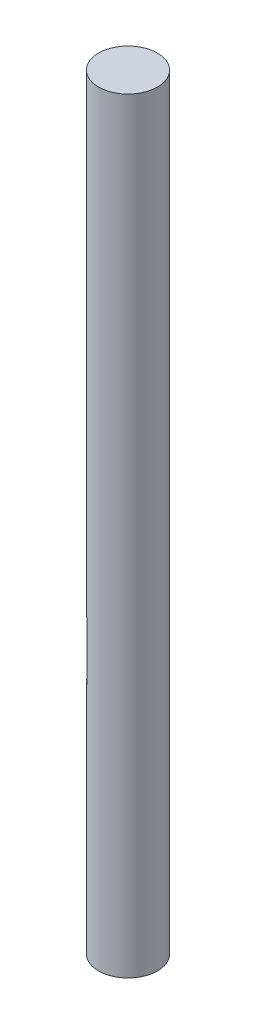
from build123d import *

# Parameters (mm, degrees)
SKETCH1_R           = 3.175
BOSS_EXTRUDE1_DEPTH = 28.575
CUT_EXTRUDE1_START  = -28.575
CUT_EXTRUDE1_DEPTH  = 3.175
BOSS_EXTRUDE2_START = 25.4
SKETCH3_R           = 3.175
BOSS_EXTRUDE2_DEPTH = 25.4


with BuildPart() as part:
    # Sketch1 → Boss-Extrude1 (new, symmetric)
    with BuildSketch(Plane(origin=(0, 0, 0), x_dir=(1, 0, 0), z_dir=(0, 1, 0))):
        with Locations(Location((0, 0, 0), (0, 0, 270))):
            Circle(SKETCH1_R)
    extrude(amount=BOSS_EXTRUDE1_DEPTH, both=True)

    # Sketch2 → Cut-Extrude1 (cut, symmetric)
    with BuildSketch(Plane(origin=(0, 28.575, 0), x_dir=(1, 0, 0), z_dir=(0, 1, 0)).offset(CUT_EXTRUDE1_START)):
        with BuildLine():
            Line((-1.905, 2.54), (-1.905, -2.54))
            ThreePointArc((-1.905, -2.54), (-3.175, 0), (-1.905, 2.54))
        make_face()
    extrude(amount=CUT_EXTRUDE1_DEPTH, both=True, mode=Mode.SUBTRACT)

    # Sketch3 → Boss-Extrude2 (add)
    with BuildSketch(Plane(origin=(0, 28.575, 0), x_dir=(1, 0, 0), z_dir=(0, 1, 0)).offset(BOSS_EXTRUDE2_START)):
        with Locations(Location((0, 0, 0), (0, 0, 270))):
            Circle(SKETCH3_R)
    extrude(amount=-BOSS_EXTRUDE2_DEPTH)


solid = part.part
